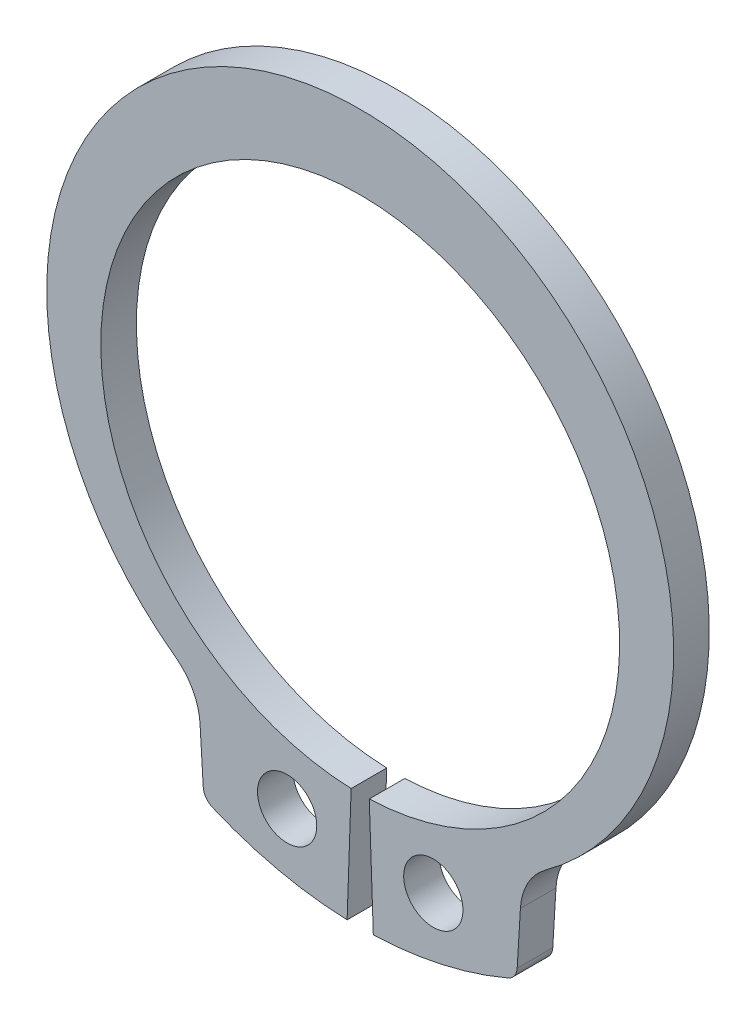
from build123d import *

# Parameters (mm, degrees)
SKETCH4_R           = 1
BOSS_EXTRUDE1_DEPTH = 0.6
FILLET1_R           = 2.053998645
FILLET2_R           = 0.513499661


with BuildPart() as part:
    # Sketch4 → Boss-Extrude1 (new, symmetric)
    with BuildSketch(Plane.XY):
        with BuildLine():
            Line((-5.275740901, -11.50583326), (-5.464092731, -8.37518302))
            ThreePointArc((-5.464092731, -8.37518302), (-10.185824929, 3.512708233), (0, 11.25))
            Line((0, 11.25), (0, 8.75))
            ThreePointArc((0, 8.75), (-8.748667333, 0.152708556), (-0.305370596, -8.744669736))
            Line((-0.305370596, -8.744669736), (-0.441747734, -12.65))
            ThreePointArc((-0.441747734, -12.65), (-2.915424233, -12.317383756), (-5.275740901, -11.50583326))
        make_face()
        with Locations((-2.465396783, -10.416061561)):
            Circle(SKETCH4_R, mode=Mode.SUBTRACT)
    extrude(amount=BOSS_EXTRUDE1_DEPTH, both=True)

    # Fillet1
    fillet1_edges = [part.edges().sort_by_distance(p)[0] for p in [
        (-5.464092731, -8.37518302, 0),
    ]]
    fillet(fillet1_edges, radius=FILLET1_R)

    # Fillet2
    fillet2_edges = [part.edges().sort_by_distance(p)[0] for p in [
        (-5.275740901, -11.50583326, 0),
    ]]
    fillet(fillet2_edges, radius=FILLET2_R)

    # Mirror1: part across plane


with BuildPart() as part_1:
    add(part.part)
    add(part.part.mirror(Plane(origin=(0, 11.25, 0.6), x_dir=(0, 0, 1), z_dir=(-1, 0, 0))))


solid = part_1.part
